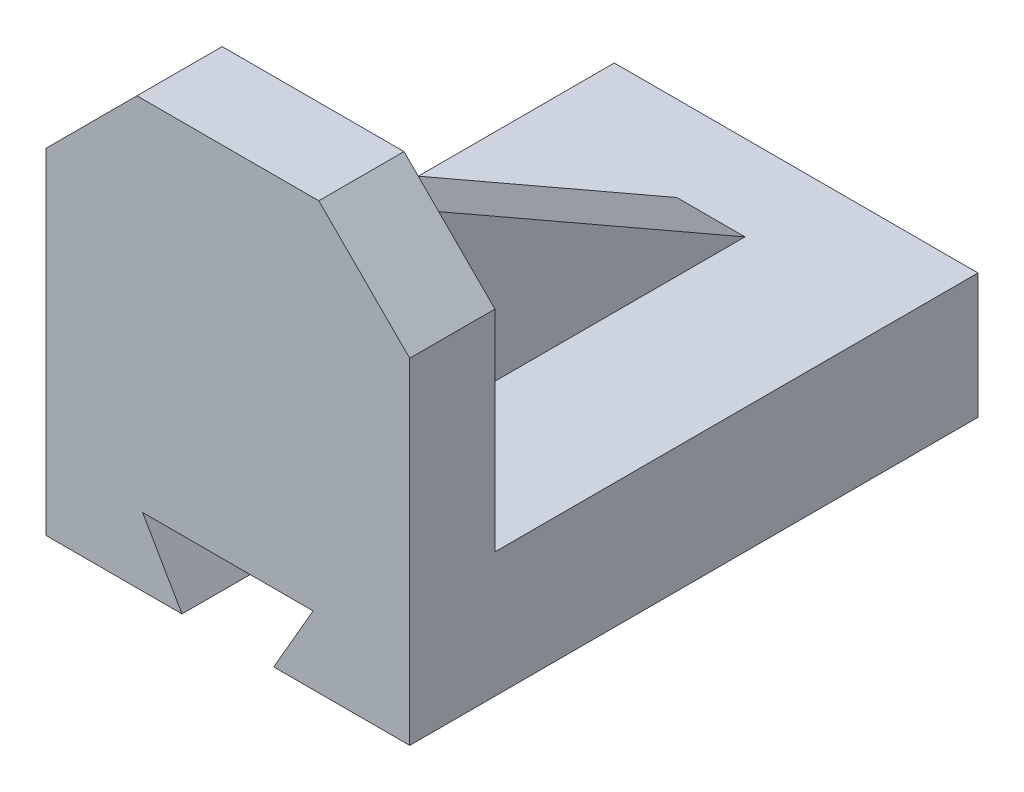
from build123d import *

# Parameters (mm, degrees)
BOSS_EXTRUDE3_DEPTH     = 32
BOSS_EXTRUDE4_DEPTH     = 6
CUT_EXTRUDE1_DEPTH      = 106.157025443
CUT_EXTRUDE1_DEPTH_BACK = 106.157025443
CUT_EXTRUDE2_DEPTH      = 106.157025443
CUT_EXTRUDE2_DEPTH_BACK = 106.157025443


with BuildPart() as part:
    # Sketch2 → Boss-Extrude3 (new, symmetric)
    with BuildSketch(Plane(origin=(0, 0, 0), x_dir=(0, 0, -1), z_dir=(1, 0, 0))):
        Polygon((70, 0), (0, 0), (0, 40), (0, 53), (-15, 53), (-15, -22), (85, -22), (85, 0), align=None)
    extrude(amount=BOSS_EXTRUDE3_DEPTH, both=True)

    # Sketch2<5> → Boss-Extrude4 (add, symmetric)
    with BuildSketch(Plane(origin=(0, 0, 0), x_dir=(0, 0, -1), z_dir=(1, 0, 0))):
        Polygon((0, 40), (0, 0), (70, 0), align=None)
    extrude(amount=BOSS_EXTRUDE4_DEPTH, both=True)

    # Sketch5 → Cut-Extrude1 (cut, two sides: drawn at the far end of the back side and taken through both)
    with BuildSketch(Plane.XY.offset(-CUT_EXTRUDE1_DEPTH_BACK)):
        Polygon((-8.07179677, -22), (8.07179677, -22), (15, -10), (-15, -10), align=None)
    extrude(amount=CUT_EXTRUDE1_DEPTH + CUT_EXTRUDE1_DEPTH_BACK, mode=Mode.SUBTRACT)

    # Sketch5<3> → Cut-Extrude2 (cut, two sides: drawn at the far end of the back side and taken through both)
    with BuildSketch(Plane.XY.offset(-CUT_EXTRUDE2_DEPTH_BACK)):
        Polygon((32, 53), (16, 53), (32, 37), align=None)
        Polygon((-16, 53), (-32, 53), (-32, 37), align=None)
    extrude(amount=CUT_EXTRUDE2_DEPTH + CUT_EXTRUDE2_DEPTH_BACK, mode=Mode.SUBTRACT)


solid = part.part
